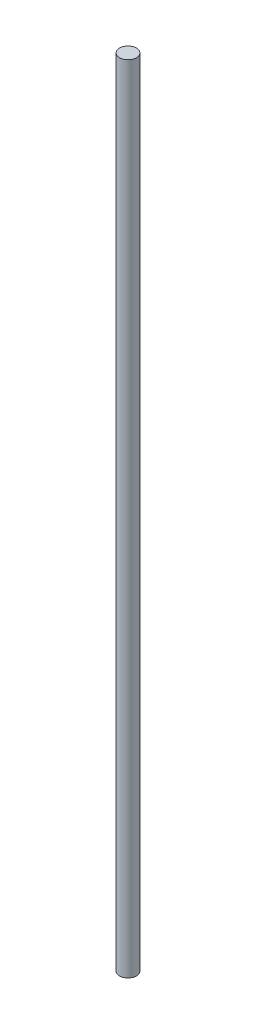
from build123d import *

# Parameters (mm, degrees)
CROQUIS1_R              = 4
SALIENTE_EXTRUIR1_DEPTH = 377.5


with BuildPart() as part:
    # Croquis1 → Saliente-Extruir1 (new body)
    with BuildSketch(Plane(origin=(0, 0, 0), x_dir=(1, 0, 0), z_dir=(0, 1, 0))):
        with Locations(Location((-8.568340902, 5.41821557, 0), (0, 0, 270))):
            Circle(CROQUIS1_R)
    extrude(amount=SALIENTE_EXTRUIR1_DEPTH)


solid = part.part
